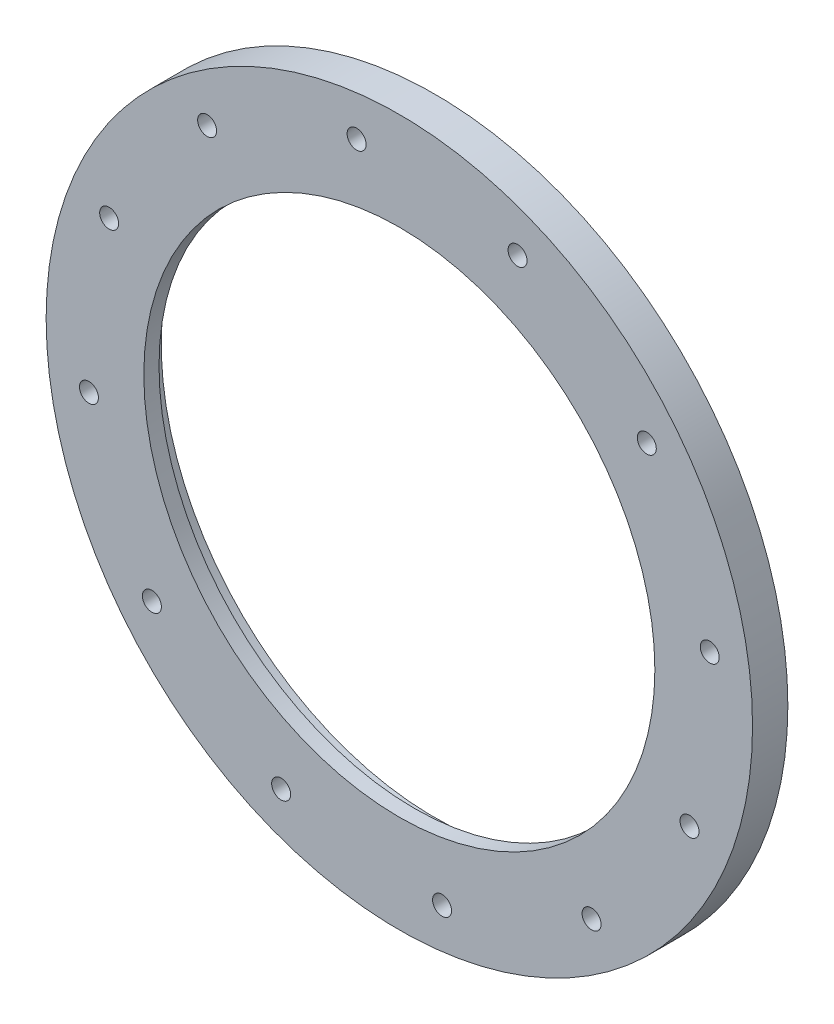
from build123d import *

# Parameters (mm, degrees)
SKETCH1_R               = 46.5
SKETCH1_R_2             = 36
BOSS_EXTRUDE1_DEPTH     = 2.325
BOSS_EXTRUDE2_START     = -2
SKETCH2_R               = 36
SKETCH2_R_2             = 33.63888889
BOSS_EXTRUDE2_DEPTH     = 2
CUT_EXTRUDE1_DEPTH      = 66.925127986
CUT_EXTRUDE1_DEPTH_BACK = 66.925127986
SKETCH3_R               = 1.25


with BuildPart() as part:
    # Sketch1 → Boss-Extrude1 (new, symmetric)
    with BuildSketch(Plane.XY):
        Circle(SKETCH1_R)
        Circle(SKETCH1_R_2, mode=Mode.SUBTRACT)
    extrude(amount=BOSS_EXTRUDE1_DEPTH, both=True)

    # Sketch2 → Boss-Extrude2 (add)
    with BuildSketch(Plane.XY.offset(2.325).offset(BOSS_EXTRUDE2_START)):
        Circle(SKETCH2_R)
        Circle(SKETCH2_R_2, mode=Mode.SUBTRACT)
    extrude(amount=BOSS_EXTRUDE2_DEPTH)

    # Sketch3 → Cut-Extrude1 (cut, two sides: drawn at the far end of the back side and taken through both)
    with BuildSketch(Plane.XY.offset(2.325).offset(-CUT_EXTRUDE1_DEPTH_BACK)):
        with Locations((-15.560126668, -38.202682603)):
            Circle(SKETCH3_R)
        with Locations((-32.576806282, -25.304430293)):
            Circle(SKETCH3_R)
        with Locations((-40.864556961, -5.625876321)):
            Circle(SKETCH3_R)
        with Locations((-38.202682603, 15.560126668)):
            Circle(SKETCH3_R)
        with Locations((-25.304430293, 32.576806282)):
            Circle(SKETCH3_R)
        with Locations((-5.625876321, 40.864556961)):
            Circle(SKETCH3_R)
        with Locations((15.560126668, 38.202682603)):
            Circle(SKETCH3_R)
        with Locations((32.576806282, 25.304430293)):
            Circle(SKETCH3_R)
        with Locations((40.864556961, 5.625876321)):
            Circle(SKETCH3_R)
        with Locations((38.202682603, -15.560126668)):
            Circle(SKETCH3_R)
        with Locations((25.304430293, -32.576806282)):
            Circle(SKETCH3_R)
        with Locations((5.625876321, -40.864556961)):
            Circle(SKETCH3_R)
    extrude(amount=CUT_EXTRUDE1_DEPTH + CUT_EXTRUDE1_DEPTH_BACK, mode=Mode.SUBTRACT)


solid = part.part
